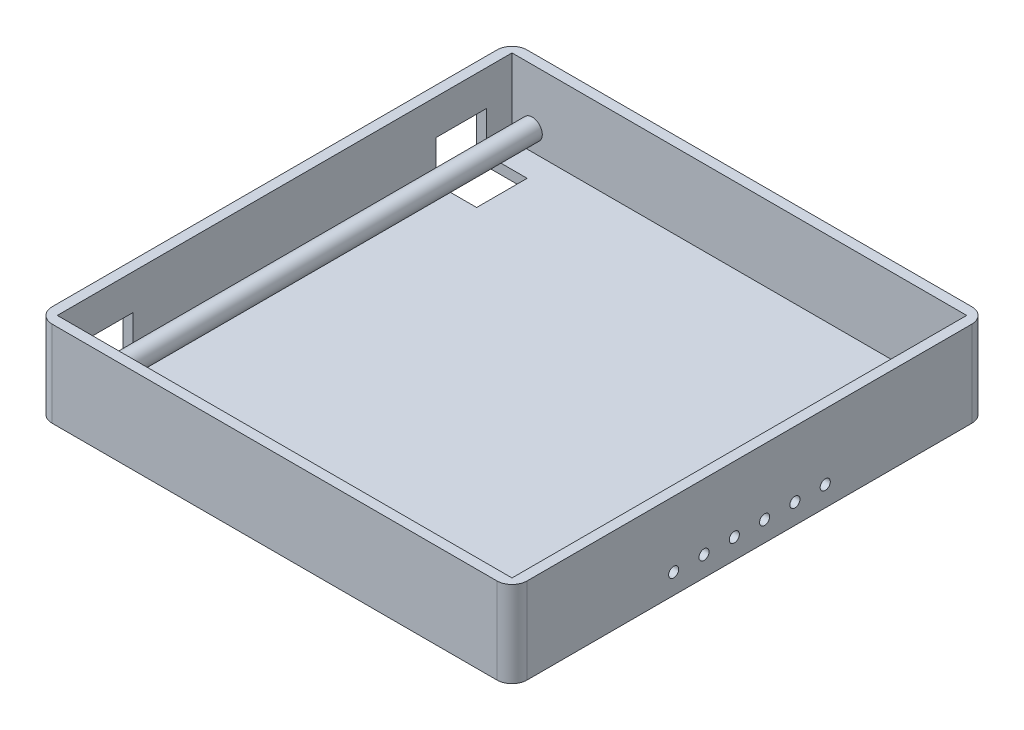
from build123d import *

# Parameters (mm, degrees)
SKETCH1_W           = 47
SKETCH1_H           = 47
BOSS_EXTRUDE1_DEPTH = 1
SKETCH2_W           = 47
SKETCH2_H           = 47
SKETCH2_W_2         = 45
SKETCH2_H_2         = 45
BOSS_EXTRUDE2_DEPTH = 7.5
SKETCH4_R           = 0.5
CUT_EXTRUDE3_DEPTH  = 1
LPATTERN1_COUNT     = 6
LPATTERN1_PITCH     = 3
FILLET1_R           = 1.5
SKETCH8_W           = 5
SKETCH8_H           = 5
CUT_EXTRUDE4_DEPTH  = 5
BOSS_EXTRUDE3_REACH = 68.312
SKETCH9_R           = 1


with BuildPart() as part:
    # Sketch1 → Boss-Extrude1 (new body)
    with BuildSketch(Plane(origin=(0, 0, 0), x_dir=(1, 0, 0), z_dir=(0, 1, 0))):
        with Locations((23.5, 23.5)):
            Rectangle(SKETCH1_W, SKETCH1_H)
    extrude(amount=BOSS_EXTRUDE1_DEPTH)

    # Sketch2 → Boss-Extrude2 (add)
    with BuildSketch(Plane(origin=(0, 1, 0), x_dir=(1, 0, 0), z_dir=(0, 1, 0))):
        with Locations((23.5, 23.5)):
            Rectangle(SKETCH2_W, SKETCH2_H)
        with Locations((23.5, 23.5)):
            Rectangle(SKETCH2_W_2, SKETCH2_H_2, mode=Mode.SUBTRACT)
    extrude(amount=BOSS_EXTRUDE2_DEPTH)

    # Sketch4 → Cut-Extrude3 (cut)
    with BuildSketch(Plane(origin=(47, 0, 0), x_dir=(0, 0, -1), z_dir=(1, 0, 0))):
        with Locations((16, 2)):
            Circle(SKETCH4_R)
    cut_extrude3 = extrude(amount=-CUT_EXTRUDE3_DEPTH, mode=Mode.SUBTRACT)

    # LPattern1: Cut-Extrude3 ×6
    with Locations(*[(0, 0, -i * LPATTERN1_PITCH) for i in range(1, LPATTERN1_COUNT)]):
        add(cut_extrude3, mode=Mode.SUBTRACT)

    # Fillet1
    fillet1_edges = [part.edges().sort_by_distance(p)[0] for p in [
        (0, 4.25, -47),
        (47, 4.25, -47),
        (47, 4.25, 0),
        (0, 4.25, 0),
    ]]
    fillet(fillet1_edges, radius=FILLET1_R)

    # Sketch8 → Cut-Extrude4 (cut)
    with BuildSketch(Plane.ZY):
        with Locations((-41, 2.5)):
            Rectangle(SKETCH8_W, SKETCH8_H)
        with Locations((-6, 2.5)):
            Rectangle(SKETCH8_W, SKETCH8_H)
    extrude(amount=-CUT_EXTRUDE4_DEPTH, mode=Mode.SUBTRACT)

    # Sketch9 → Boss-Extrude3 (add, up to next)
    with BuildSketch(Plane.XY.offset(-46), mode=Mode.PRIVATE) as boss_extrude3_sk1:
        with Locations(Location((3, 3, 0), (0, 0, 180))):
            Circle(SKETCH9_R)
    boss_extrude3_tool1 = extrude(boss_extrude3_sk1.sketch, amount=BOSS_EXTRUDE3_REACH, mode=Mode.PRIVATE) - part.part
    add(boss_extrude3_tool1.solids().sort_by_distance((3, 3, -46))[0])


solid = part.part
